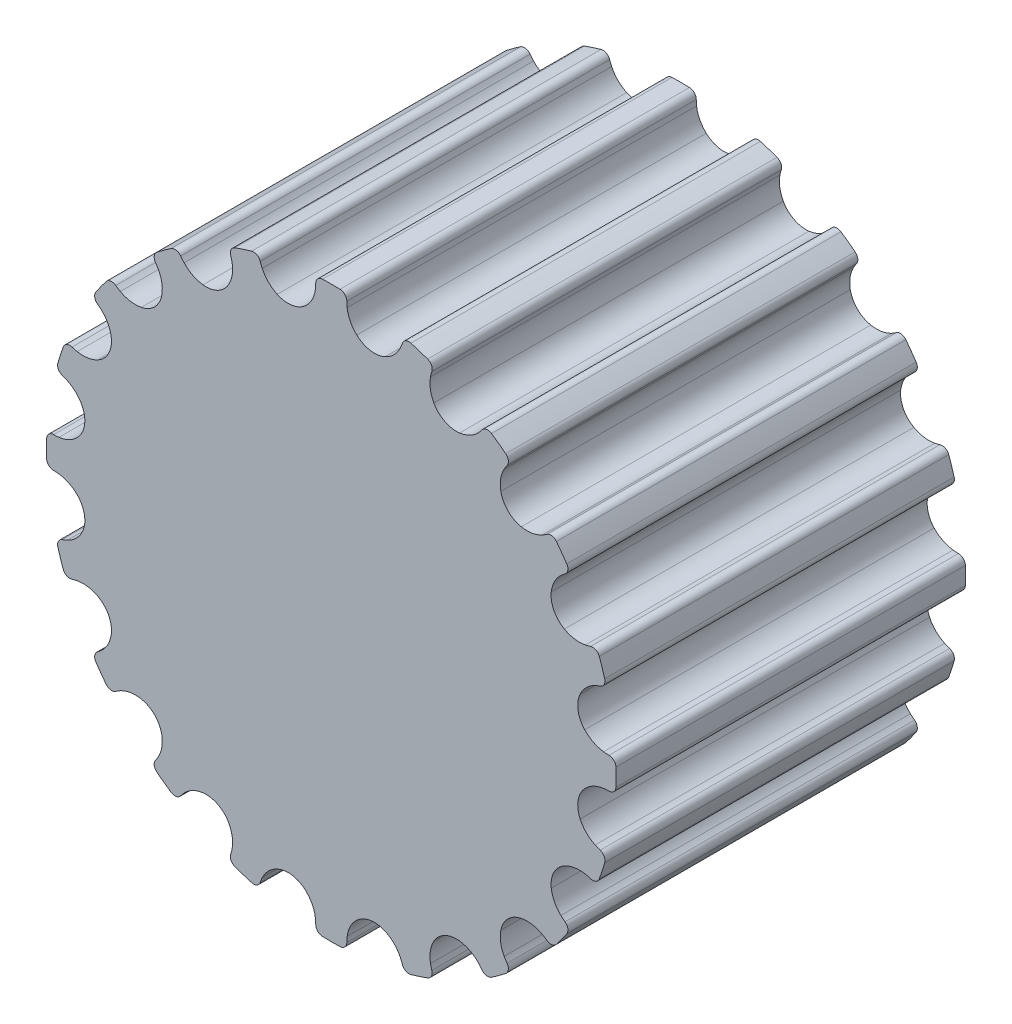
from build123d import *

# Parameters (mm, degrees)
BOSS_EXTRUDE1_DEPTH = 7.5
CIRPATTERN1_COUNT   = 20
SKETCH2_R           = 5.362197724
BOSS_EXTRUDE2_DEPTH = 7.5


with BuildPart() as part:
    # Sketch1 → Boss-Extrude1 (new body)
    with BuildSketch(Plane.XY):
        with BuildLine():
            ThreePointArc((0.838832532, 5.296180172), (0.682371389, 5.345509816), (0.547166891, 5.438425083))
            ThreePointArc((0.547166891, 5.438425083), (0.408048432, 5.623143766), (0.340639395, 5.844347201))
            ThreePointArc((0.340639395, 5.844347201), (0.335313092, 5.902123138), (0.333346558, 5.960110732))
            ThreePointArc((0.333346558, 5.960110732), (0.290777478, 6.064063067), (0.187961119, 6.109306968))
            ThreePointArc((0.187961119, 6.109306968), (0, 6.112197724), (-0.187961119, 6.109306968))
            ThreePointArc((-0.187961119, 6.109306968), (-0.290777478, 6.064063067), (-0.333346558, 5.960110732))
            ThreePointArc((-0.333346558, 5.960110732), (-0.335313092, 5.902123138), (-0.340639395, 5.844347201))
            ThreePointArc((-0.340639395, 5.844347201), (-0.408048432, 5.623143766), (-0.547166891, 5.438425083))
            ThreePointArc((-0.547166891, 5.438425083), (-0.682371389, 5.345509816), (-0.838832532, 5.296180172))
            ThreePointArc((-0.838832532, 5.296180172), (0, 5.362197724), (0.838832532, 5.296180172))
        make_face()
    extrude(amount=BOSS_EXTRUDE1_DEPTH)


with BuildPart() as cirpattern1_1:
    # CirPattern1: pattern copy
    add(part.part.rotate(Axis((0, 0, 0), (0, 0, 1)), 1 * 360 / CIRPATTERN1_COUNT))


with BuildPart() as cirpattern1_2:
    # CirPattern1: pattern copy
    add(part.part.rotate(Axis((0, 0, 0), (0, 0, 1)), 2 * 360 / CIRPATTERN1_COUNT))


with BuildPart() as cirpattern1_3:
    # CirPattern1: pattern copy
    add(part.part.rotate(Axis((0, 0, 0), (0, 0, 1)), 3 * 360 / CIRPATTERN1_COUNT))


with BuildPart() as cirpattern1_4:
    # CirPattern1: pattern copy
    add(part.part.rotate(Axis((0, 0, 0), (0, 0, 1)), 4 * 360 / CIRPATTERN1_COUNT))


with BuildPart() as cirpattern1_5:
    # CirPattern1: pattern copy
    add(part.part.rotate(Axis((0, 0, 0), (0, 0, 1)), 5 * 360 / CIRPATTERN1_COUNT))


with BuildPart() as cirpattern1_6:
    # CirPattern1: pattern copy
    add(part.part.rotate(Axis((0, 0, 0), (0, 0, 1)), 6 * 360 / CIRPATTERN1_COUNT))


with BuildPart() as cirpattern1_7:
    # CirPattern1: pattern copy
    add(part.part.rotate(Axis((0, 0, 0), (0, 0, 1)), 7 * 360 / CIRPATTERN1_COUNT))


with BuildPart() as cirpattern1_8:
    # CirPattern1: pattern copy
    add(part.part.rotate(Axis((0, 0, 0), (0, 0, 1)), 8 * 360 / CIRPATTERN1_COUNT))


with BuildPart() as cirpattern1_9:
    # CirPattern1: pattern copy
    add(part.part.rotate(Axis((0, 0, 0), (0, 0, 1)), 9 * 360 / CIRPATTERN1_COUNT))


with BuildPart() as cirpattern1_10:
    # CirPattern1: pattern copy
    add(part.part.rotate(Axis((0, 0, 0), (0, 0, 1)), 10 * 360 / CIRPATTERN1_COUNT))


with BuildPart() as cirpattern1_11:
    # CirPattern1: pattern copy
    add(part.part.rotate(Axis((0, 0, 0), (0, 0, 1)), 11 * 360 / CIRPATTERN1_COUNT))


with BuildPart() as cirpattern1_12:
    # CirPattern1: pattern copy
    add(part.part.rotate(Axis((0, 0, 0), (0, 0, 1)), 12 * 360 / CIRPATTERN1_COUNT))


with BuildPart() as cirpattern1_13:
    # CirPattern1: pattern copy
    add(part.part.rotate(Axis((0, 0, 0), (0, 0, 1)), 13 * 360 / CIRPATTERN1_COUNT))


with BuildPart() as cirpattern1_14:
    # CirPattern1: pattern copy
    add(part.part.rotate(Axis((0, 0, 0), (0, 0, 1)), 14 * 360 / CIRPATTERN1_COUNT))


with BuildPart() as cirpattern1_15:
    # CirPattern1: pattern copy
    add(part.part.rotate(Axis((0, 0, 0), (0, 0, 1)), 15 * 360 / CIRPATTERN1_COUNT))


with BuildPart() as cirpattern1_16:
    # CirPattern1: pattern copy
    add(part.part.rotate(Axis((0, 0, 0), (0, 0, 1)), 16 * 360 / CIRPATTERN1_COUNT))


with BuildPart() as cirpattern1_17:
    # CirPattern1: pattern copy
    add(part.part.rotate(Axis((0, 0, 0), (0, 0, 1)), 17 * 360 / CIRPATTERN1_COUNT))


with BuildPart() as cirpattern1_18:
    # CirPattern1: pattern copy
    add(part.part.rotate(Axis((0, 0, 0), (0, 0, 1)), 18 * 360 / CIRPATTERN1_COUNT))


with BuildPart() as cirpattern1_19:
    # CirPattern1: pattern copy
    add(part.part.rotate(Axis((0, 0, 0), (0, 0, 1)), 19 * 360 / CIRPATTERN1_COUNT))


with BuildPart() as part_1:
    add(part.part)

    add(cirpattern1_1.part)  # Boss-Extrude2 merges CirPattern1_1

    add(cirpattern1_2.part)  # Boss-Extrude2 merges CirPattern1_2

    add(cirpattern1_3.part)  # Boss-Extrude2 merges CirPattern1_3

    add(cirpattern1_4.part)  # Boss-Extrude2 merges CirPattern1_4

    add(cirpattern1_5.part)  # Boss-Extrude2 merges CirPattern1_5

    add(cirpattern1_6.part)  # Boss-Extrude2 merges CirPattern1_6

    add(cirpattern1_7.part)  # Boss-Extrude2 merges CirPattern1_7

    add(cirpattern1_8.part)  # Boss-Extrude2 merges CirPattern1_8

    add(cirpattern1_9.part)  # Boss-Extrude2 merges CirPattern1_9

    add(cirpattern1_10.part)  # Boss-Extrude2 merges CirPattern1_10

    add(cirpattern1_11.part)  # Boss-Extrude2 merges CirPattern1_11

    add(cirpattern1_12.part)  # Boss-Extrude2 merges CirPattern1_12

    add(cirpattern1_13.part)  # Boss-Extrude2 merges CirPattern1_13

    add(cirpattern1_14.part)  # Boss-Extrude2 merges CirPattern1_14

    add(cirpattern1_15.part)  # Boss-Extrude2 merges CirPattern1_15

    add(cirpattern1_16.part)  # Boss-Extrude2 merges CirPattern1_16

    add(cirpattern1_17.part)  # Boss-Extrude2 merges CirPattern1_17

    add(cirpattern1_18.part)  # Boss-Extrude2 merges CirPattern1_18

    add(cirpattern1_19.part)  # Boss-Extrude2 merges CirPattern1_19
    # Sketch2 → Boss-Extrude2 (add)
    with BuildSketch(Plane(origin=(0, 0, 0), x_dir=(-1, 0, 0), z_dir=(0, 0, -1))):
        Circle(SKETCH2_R)
    extrude(amount=-BOSS_EXTRUDE2_DEPTH)


solid = part_1.part
